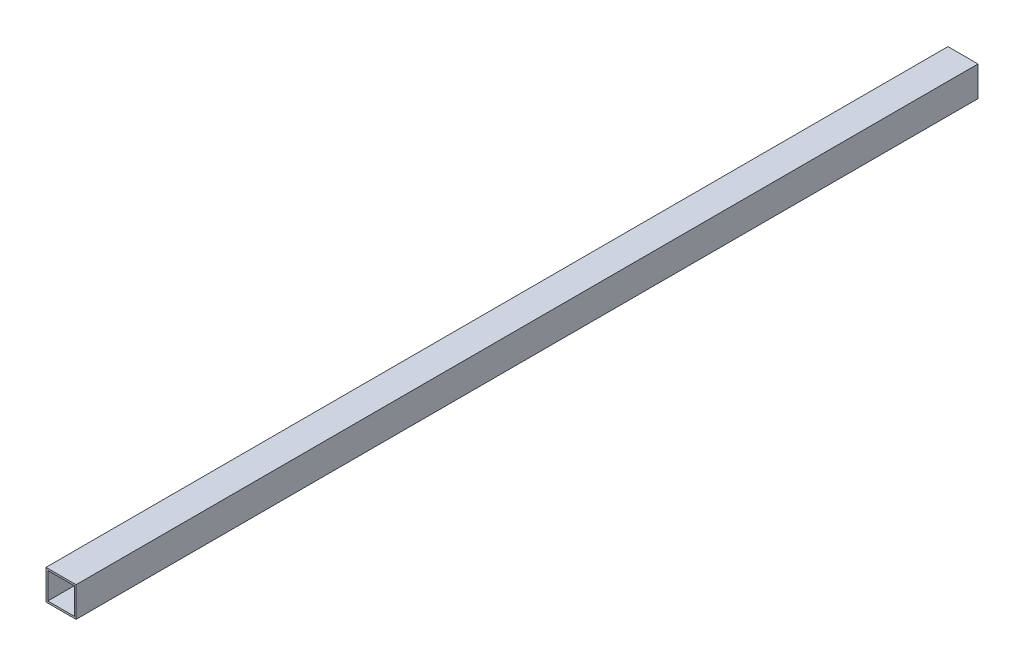
from build123d import *

# Parameters (mm, degrees)
CROQUIS1_W              = 50
CROQUIS1_H              = 50
CROQUIS1_W_2            = 44
CROQUIS1_H_2            = 44
SALIENTE_EXTRUIR1_DEPTH = 750


with BuildPart() as part:
    # Croquis1 → Saliente-Extruir1 (new, symmetric)
    with BuildSketch(Plane.XY):
        Rectangle(CROQUIS1_W, CROQUIS1_H)
        Rectangle(CROQUIS1_W_2, CROQUIS1_H_2, mode=Mode.SUBTRACT)
    extrude(amount=SALIENTE_EXTRUIR1_DEPTH, both=True)


solid = part.part
